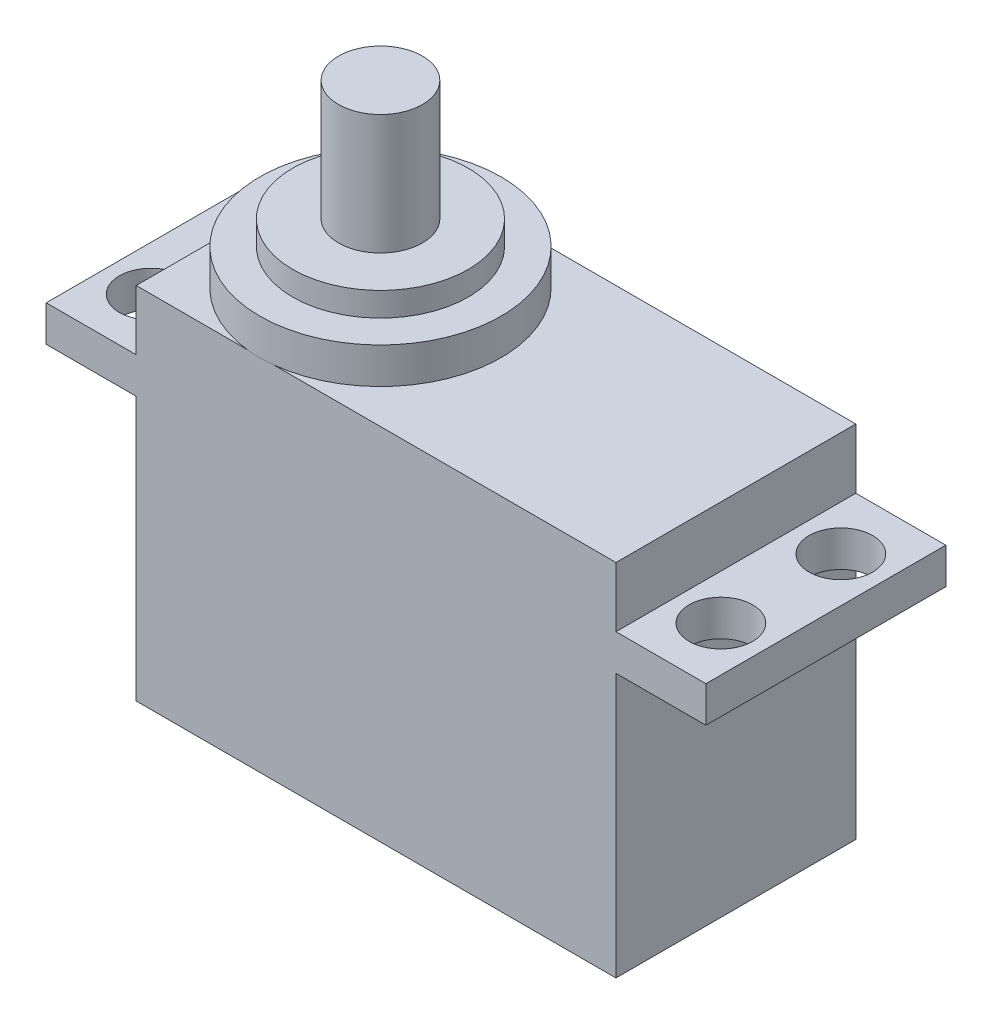
from build123d import *

# Parameters (mm, degrees)
IZIM1_W                     = 40
IZIM1_H                     = 20
Y_KSEKLIK_EKSTR_ZYON1_DEPTH = 30
IZIM2_W                     = 55
IZIM2_H                     = 20
Y_KSEKLIK_EKSTR_ZYON2_DEPTH = 3
IZIM3_R                     = 2.647008292
KES_EKSTR_ZYON1_DEPTH       = 13
IZIM4_R                     = 10.060368761
Y_KSEKLIK_EKSTR_ZYON3_DEPTH = 3
IZIM5_R                     = 7.317651021
Y_KSEKLIK_EKSTR_ZYON4_DEPTH = 2
IZIM6_R                     = 3.5
Y_KSEKLIK_EKSTR_ZYON5_DEPTH = 10


with BuildPart() as part:
    # Çizim1 → Yükseklik-Ekstrüzyon1 (new body)
    with BuildSketch(Plane(origin=(0, 0, 0), x_dir=(1, 0, 0), z_dir=(0, 1, 0))):
        Rectangle(IZIM1_W, IZIM1_H)
    extrude(amount=Y_KSEKLIK_EKSTR_ZYON1_DEPTH)

    # Çizim2 → Yükseklik-Ekstrüzyon2 (add)
    with BuildSketch(Plane(origin=(0, 22, 0), x_dir=(1, 0, 0), z_dir=(0, 1, 0))):
        Rectangle(IZIM2_W, IZIM2_H)
    extrude(amount=Y_KSEKLIK_EKSTR_ZYON2_DEPTH)

    # Çizim3 → Kes-Ekstrüzyon1 (cut)
    with BuildSketch(Plane(origin=(0, 25, 0), x_dir=(1, 0, 0), z_dir=(0, 1, 0))):
        with Locations(Location((-23.75, 5.00174063, 0), (0, 0, 270))):
            Circle(IZIM3_R)
        with Locations(Location((-23.75, -5.00174063, 0), (0, 0, 90))):
            Circle(IZIM3_R)
        with Locations(Location((23.75, -5.00174063, 0), (0, 0, 270))):
            Circle(IZIM3_R)
        with Locations(Location((23.75, 5.00174063, 0), (0, 0, 90))):
            Circle(IZIM3_R)
    extrude(amount=-KES_EKSTR_ZYON1_DEPTH, mode=Mode.SUBTRACT)

    # Çizim4 → Yükseklik-Ekstrüzyon3 (add)
    with BuildSketch(Plane(origin=(0, 30, 0), x_dir=(1, 0, 0), z_dir=(0, 1, 0))):
        with Locations(Location((-9.631551276, 0, 0), (0, 0, 96.279921615))):
            Circle(IZIM4_R)
    extrude(amount=Y_KSEKLIK_EKSTR_ZYON3_DEPTH)

    # Çizim5 → Yükseklik-Ekstrüzyon4 (add)
    with BuildSketch(Plane(origin=(0, 33, 0), x_dir=(1, 0, 0), z_dir=(0, 1, 0))):
        with Locations(Location((-9.631551276, 0, 0), (0, 0, 270))):
            Circle(IZIM5_R)
    extrude(amount=Y_KSEKLIK_EKSTR_ZYON4_DEPTH)

    # Çizim6 → Yükseklik-Ekstrüzyon5 (add)
    with BuildSketch(Plane(origin=(0, 35, 0), x_dir=(1, 0, 0), z_dir=(0, 1, 0))):
        with Locations(Location((-9.631551276, 0, 0), (0, 0, 270))):
            Circle(IZIM6_R)
    extrude(amount=Y_KSEKLIK_EKSTR_ZYON5_DEPTH)


solid = part.part
